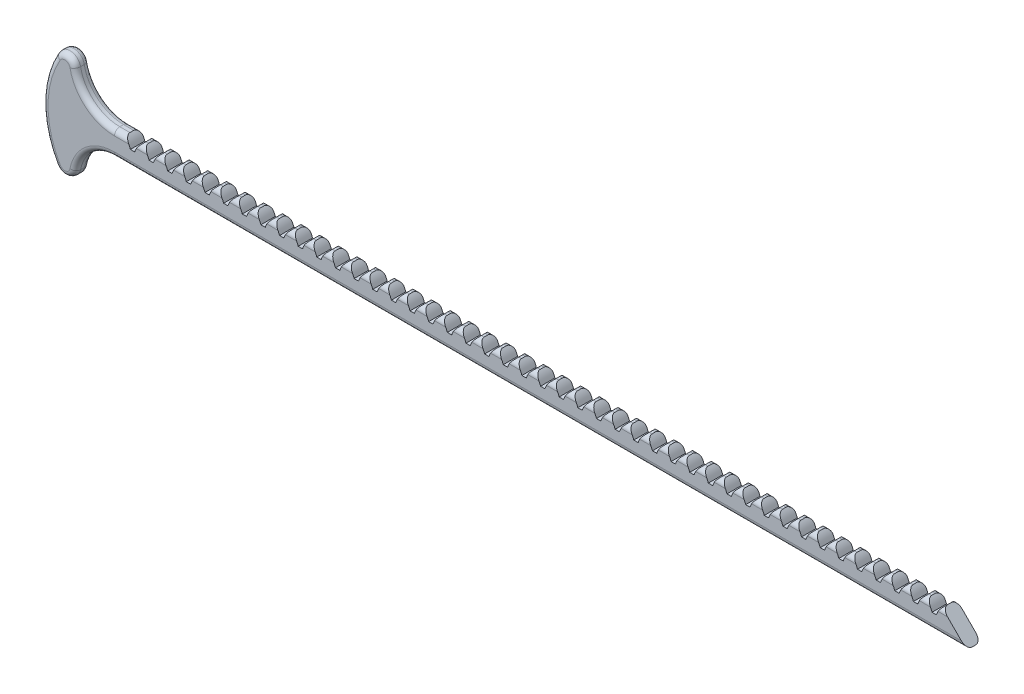
from build123d import *

# Parameters (mm, degrees)
BOSS_EXTRUDE1_DEPTH = 1.7145
FILLET1_R           = 1.27
CUT_EXTRUDE1_DEPTH  = 120.744470181
LPATTERN1_COUNT     = 44
LPATTERN1_PITCH     = 4.445


with BuildPart() as part:
    # Sketch1 → Boss-Extrude1 (new, symmetric)
    with BuildSketch(Plane.XY):
        with BuildLine():
            Line((-101.6, 0), (101.6, 0))
            Line((101.6, 0), (95.758, 5.842))
            Line((95.758, 5.842), (-101.6, 5.842))
            ThreePointArc((-101.6, 5.842), (-107.663641916, 8.021397798), (-110.952462239, 13.562263158))
            ThreePointArc((-110.952462239, 13.562263158), (-113.025527679, 15.585879752), (-115.646156695, 14.351))
            ThreePointArc((-115.646156695, 14.351), (-118.708815964, 2.921), (-115.646156695, -8.509))
            ThreePointArc((-115.646156695, -8.509), (-113.025527679, -9.743879752), (-110.952462239, -7.720263158))
            ThreePointArc((-110.952462239, -7.720263158), (-107.663641916, -2.179397798), (-101.6, 0))
        make_face()
    extrude(amount=BOSS_EXTRUDE1_DEPTH, both=True)

    # Fillet1
    fillet1_edges = [part.edges().sort_by_distance(p)[0] for p in [
        (-2.921, 5.842, -1.7145),
        (0, 0, -1.7145),
        (-107.663641916, -2.179397798, -1.7145),
        (-2.921, 5.842, 1.7145),
        (-107.663641916, 8.021397798, 1.7145),
        (-113.025527679, 15.585879752, 1.7145),
        (-118.708815964, 2.921, 1.7145),
        (-113.025527679, -9.743879752, 1.7145),
        (-107.663641916, -2.179397798, 1.7145),
        (-113.025527679, -9.743879752, -1.7145),
        (0, 0, 1.7145),
        (-118.708815964, 2.921, -1.7145),
        (-113.025527679, 15.585879752, -1.7145),
        (-107.663641916, 8.021397798, -1.7145),
    ]]
    fillet(fillet1_edges, radius=FILLET1_R)

    # Sketch3 → Cut-Extrude1 (cut, symmetric)
    with BuildSketch(Plane.XY):
        with BuildLine():
            Line((93.330919151, 3.683), (94.375080849, 3.683))
            ThreePointArc((94.375080849, 3.683), (94.928091062, 4.851181925), (95.758, 5.842))
            Line((95.758, 5.842), (91.948, 5.842))
            ThreePointArc((91.948, 5.842), (92.777908938, 4.851181925), (93.330919151, 3.683))
        make_face()
    cut_extrude1 = extrude(amount=CUT_EXTRUDE1_DEPTH, both=True, mode=Mode.SUBTRACT)

    # LPattern1: Cut-Extrude1 ×44
    with Locations(*[(-i * LPATTERN1_PITCH, 0, 0) for i in range(1, LPATTERN1_COUNT)]):
        add(cut_extrude1, mode=Mode.SUBTRACT)


solid = part.part
